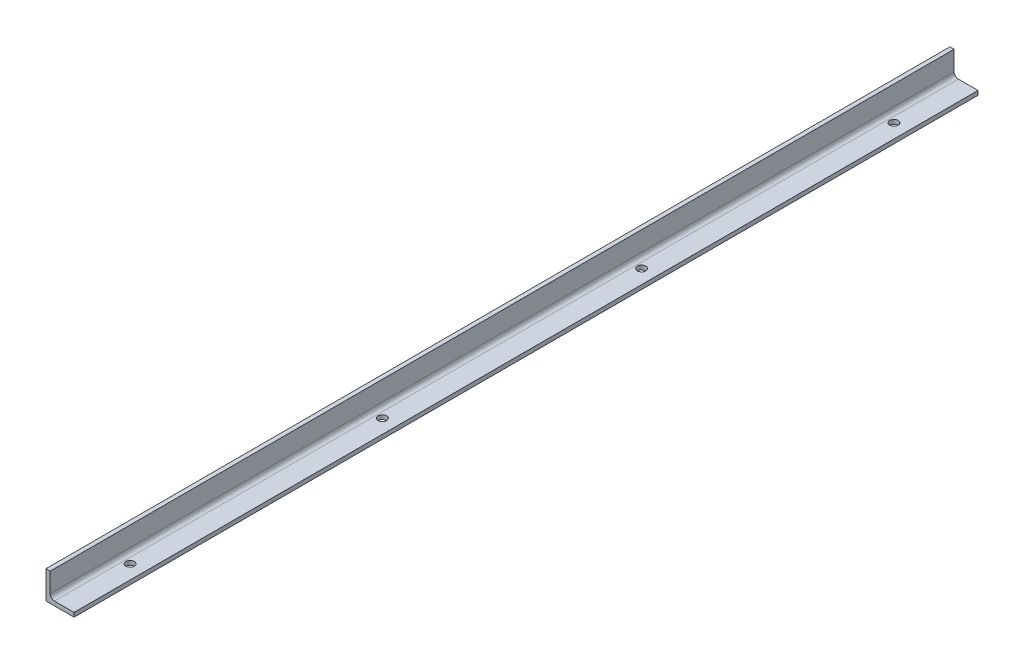
from build123d import *

# Parameters (mm, degrees)
BOSS_EXTRU_1_DEPTH      = 645
ESQUISSE2_R             = 3
ENL_V_MAT_EXTRU_1_DEPTH = 955


with BuildPart() as part:
    # Esquisse1 → Boss.-Extru.1 (new body)
    with BuildSketch(Plane.XY):
        with BuildLine():
            Line((0, 0), (0, 20))
            Line((0, 20), (3, 20))
            Line((3, 20), (3, 6))
            ThreePointArc((3, 6), (3.878679656, 3.878679656), (6, 3))
            Line((6, 3), (20, 3))
            Line((20, 3), (20, 0))
            Line((20, 0), (0, 0))
        make_face()
    extrude(amount=BOSS_EXTRU_1_DEPTH)

    # Esquisse2 → Enlèv. mat.-Extru.1 (cut)
    with BuildSketch(Plane(origin=(0, 0, 0), x_dir=(-1, 0, 0), z_dir=(0, -1, 0))):
        with Locations(Location((-10, -50, 0), (0, 0, 180))):
            Circle(ESQUISSE2_R)
        with Locations(Location((-10, -595, 0), (0, 0, 180))):
            Circle(ESQUISSE2_R)
        with Locations(Location((-10, -230, 0), (0, 0, 180))):
            Circle(ESQUISSE2_R)
        with Locations(Location((-10, -415, 0), (0, 0, 180))):
            Circle(ESQUISSE2_R)
    extrude(amount=-ENL_V_MAT_EXTRU_1_DEPTH, mode=Mode.SUBTRACT)


solid = part.part
